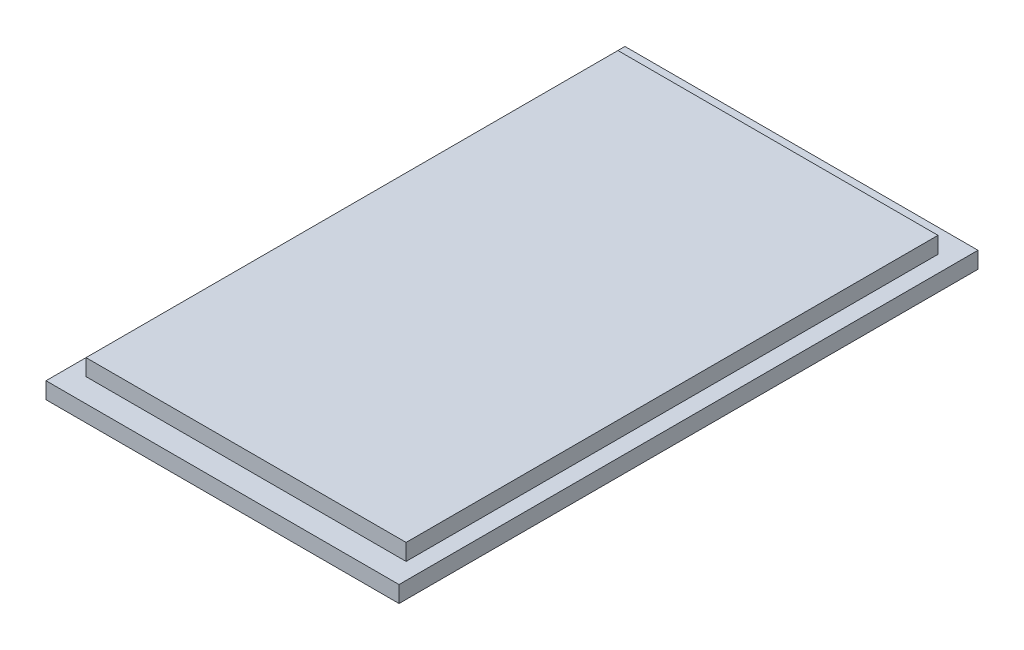
from build123d import *

# Parameters (mm, degrees)
SKETCH1_W           = 37.5
SKETCH1_H           = 61.5
BOSS_EXTRUDE1_DEPTH = 1.75
SKETCH2_W           = 34
SKETCH2_H           = 56.5
BOSS_EXTRUDE2_DEPTH = 1.75


with BuildPart() as part:
    # Sketch1 → Boss-Extrude1 (new body)
    with BuildSketch(Plane(origin=(0, 0, 0), x_dir=(1, 0, 0), z_dir=(0, 1, 0))):
        with Locations((-156.892564619, -93.318616843)):
            Rectangle(SKETCH1_W, SKETCH1_H)
    extrude(amount=BOSS_EXTRUDE1_DEPTH)

    # Sketch2 → Boss-Extrude2 (add)
    with BuildSketch(Plane(origin=(0, 1.75, 0), x_dir=(1, 0, 0), z_dir=(0, 1, 0))):
        with Locations((-156.892564619, -93.318616843)):
            Rectangle(SKETCH2_W, SKETCH2_H)
    extrude(amount=BOSS_EXTRUDE2_DEPTH)


solid = part.part
